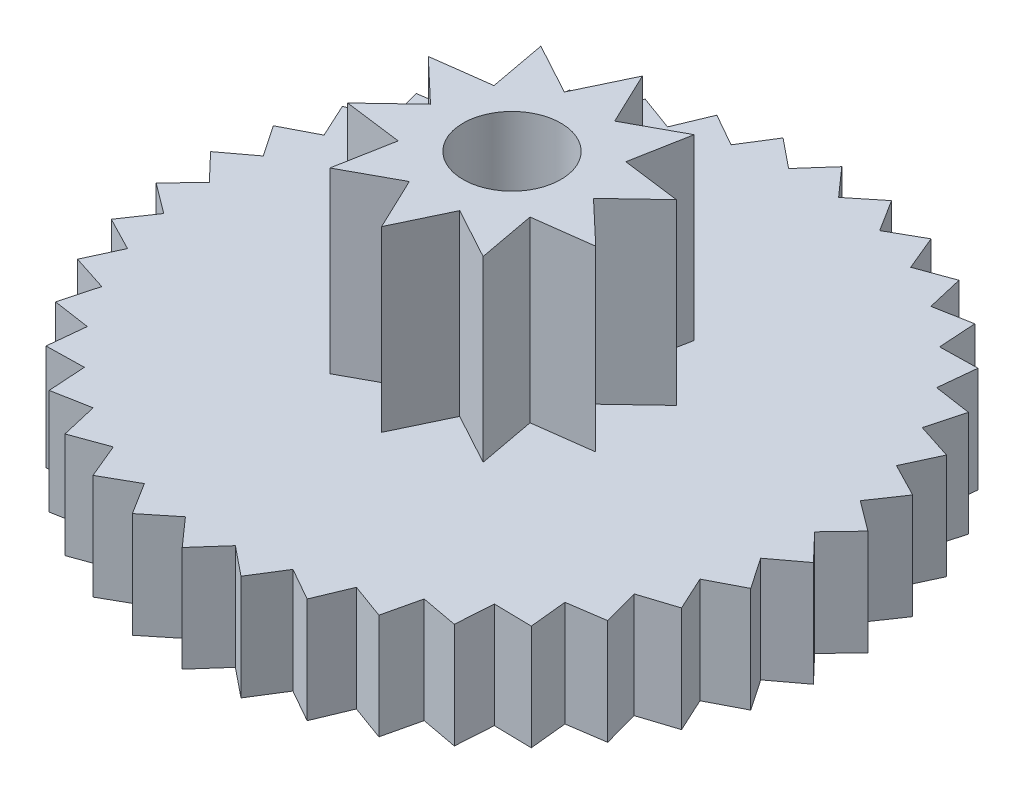
from build123d import *

# Parameters (mm, degrees)
SKETCH2_R          = 6.57
CUT_EXTRUDE1_DEPTH = 10.189570175
SKETCH3_R          = 2.9
CUT_EXTRUDE2_DEPTH = 3.28
SKETCH4_R          = 0.9
CUT_EXTRUDE3_DEPTH = 11.034288305


with BuildPart() as part:
    # Sketch1 → Revolve1 (revolve)
    with BuildSketch(Plane.XY, mode=Mode.PRIVATE) as revolve1_sk:
        Polygon((0, 5.22), (0, 1), (2.72, 1), (2.72, 0.42), (4.45, 0.42), (4.45, 0), (6.07, 0), (6.07, 1.94), (2.4, 1.94), (2.4, 5.22), align=None)
    revolve(revolve1_sk.sketch.rotate(Axis((0, 5.22, 0), (0, -1, 0)), 180), axis=Axis((0, 5.22, 0), (0, -1, 0)))

    # Sketch2 → Cut-Extrude1 (cut, through all)
    with BuildSketch(Plane(origin=(0, 1.94, 0), x_dir=(1, 0, 0), z_dir=(0, 1, 0))):
        Circle(SKETCH2_R)
        Polygon((0, 6.07), (-0.459966954, 5.550975626), (-0.999089163, 5.987213112), (-1.367354163, 5.399559481), (-1.970925778, 5.741110657), (-2.237443515, 5.100857429), (-2.889000676, 5.33840567), (-3.046501241, 4.663017284), (-3.728271166, 4.790082892), (-3.772458354, 4.097982182), (-4.465844138, 4.11109914), (-4.395512637, 3.42116481), (-5.081600523, 3.31997532), (-4.898668794, 2.651026979), (-5.558744093, 2.438291228), (-5.268202036, 1.808576043), (-5.884259614, 1.490096907), (-5.49403246, 0.916791868), (-6.049267873, 0.501256627), (-5.57, 0), (-6.049267873, -0.501256627), (-5.49403246, -0.916791868), (-5.884259614, -1.490096907), (-5.268202036, -1.808576043), (-5.558744093, -2.438291228), (-4.898668794, -2.651026979), (-5.081600523, -3.31997532), (-4.395512637, -3.42116481), (-4.465844138, -4.11109914), (-3.772458354, -4.097982182), (-3.728271166, -4.790082892), (-3.046501241, -4.663017284), (-2.889000676, -5.33840567), (-2.237443515, -5.100857429), (-1.970925778, -5.741110657), (-1.367354163, -5.399559481), (-0.999089163, -5.987213112), (-0.459966954, -5.550975626), (0, -6.07), (0.459966954, -5.550975626), (0.999089163, -5.987213112), (1.367354163, -5.399559481), (1.970925778, -5.741110657), (2.237443515, -5.100857429), (2.889000676, -5.33840567), (3.046501241, -4.663017284), (3.728271166, -4.790082892), (3.772458354, -4.097982182), (4.465844138, -4.11109914), (4.395512637, -3.42116481), (5.081600523, -3.31997532), (4.898668794, -2.651026979), (5.558744093, -2.438291228), (5.268202036, -1.808576043), (5.884259614, -1.490096907), (5.49403246, -0.916791868), (6.049267873, -0.501256627), (5.57, 0), (6.049267873, 0.501256627), (5.49403246, 0.916791868), (5.884259614, 1.490096907), (5.268202036, 1.808576043), (5.558744093, 2.438291228), (4.898668794, 2.651026979), (5.081600523, 3.31997532), (4.395512637, 3.42116481), (4.465844138, 4.11109914), (3.772458354, 4.097982182), (3.728271166, 4.790082892), (3.046501241, 4.663017284), (2.889000676, 5.33840567), (2.237443515, 5.100857429), (1.970925778, 5.741110657), (1.367354163, 5.399559481), (0.999089163, 5.987213112), (0.459966954, 5.550975626), align=None, mode=Mode.SUBTRACT)
    extrude(amount=-CUT_EXTRUDE1_DEPTH, mode=Mode.SUBTRACT)

    # Sketch3 → Cut-Extrude2 (cut)
    with BuildSketch(Plane(origin=(0, 5.22, 0), x_dir=(1, 0, 0), z_dir=(0, 1, 0))):
        Circle(SKETCH3_R)
        Polygon((0, 2.4), (-0.463525492, 1.426584774), (-1.410684606, 1.941640786), (-1.213525492, 0.881677878), (-2.282535639, 0.741640786), (-1.5, 0), (-2.282535639, -0.741640786), (-1.213525492, -0.881677878), (-1.410684606, -1.941640786), (-0.463525492, -1.426584774), (0, -2.4), (0.463525492, -1.426584774), (1.410684606, -1.941640786), (1.213525492, -0.881677878), (2.282535639, -0.741640786), (1.5, 0), (2.282535639, 0.741640786), (1.213525492, 0.881677878), (1.410684606, 1.941640786), (0.463525492, 1.426584774), align=None, mode=Mode.SUBTRACT)
    extrude(amount=-CUT_EXTRUDE2_DEPTH, mode=Mode.SUBTRACT)

    # Sketch4 → Cut-Extrude3 (cut, through all)
    with BuildSketch(Plane(origin=(0, 5.22, 0), x_dir=(1, 0, 0), z_dir=(0, 1, 0))):
        with Locations(Location((0, 0, 0), (0, 0, 180))):
            Circle(SKETCH4_R)
    extrude(amount=-CUT_EXTRUDE3_DEPTH, mode=Mode.SUBTRACT)


solid = part.part
